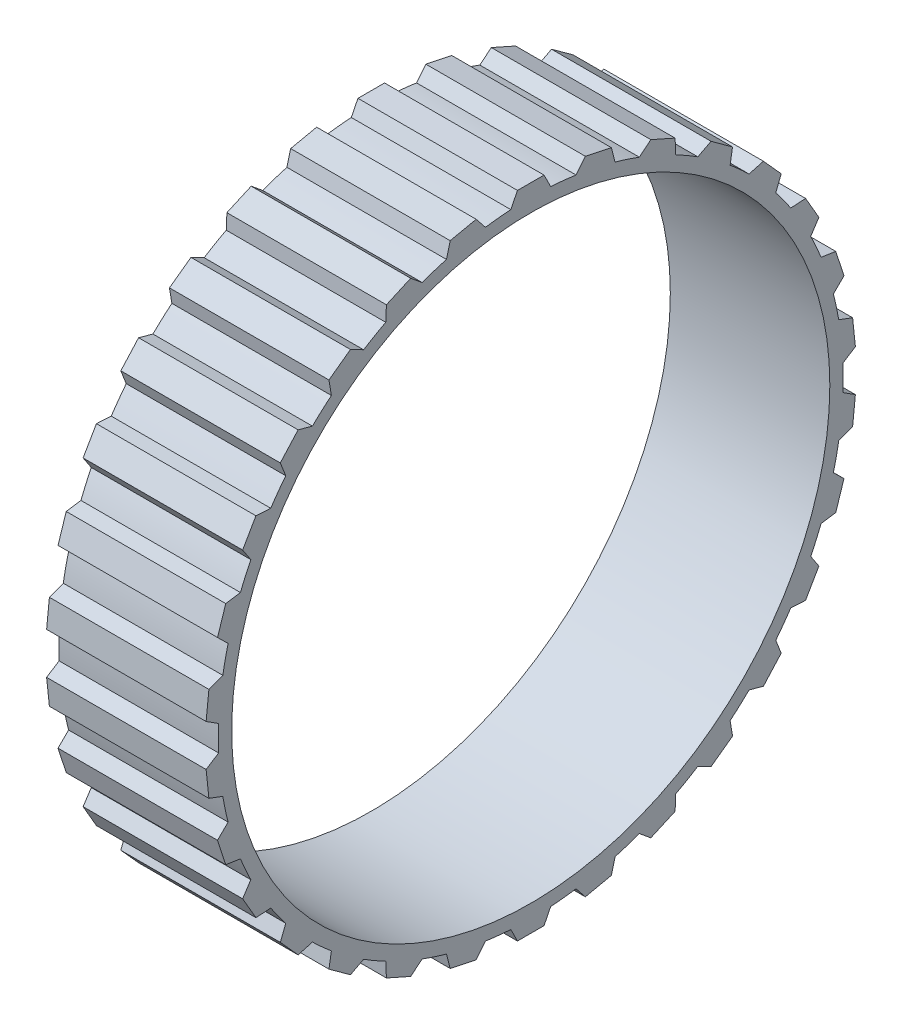
from build123d import *

# Parameters (mm, degrees)
SKETCH1_R           = 23.5
SKETCH1_R_2         = 22.5
EXTRUDE_THIN1_DEPTH = 12
BOSS_EXTRUDE2_DEPTH = 12
CIRPATTERN4_COUNT   = 30


with BuildPart() as part:
    # Sketch1 → Extrude-Thin1 (new body)
    with BuildSketch(Plane(origin=(0, 0, 0), x_dir=(0, 0, -1), z_dir=(1, 0, 0))):
        Circle(SKETCH1_R)
        Circle(SKETCH1_R_2, mode=Mode.SUBTRACT)
    extrude(amount=EXTRUDE_THIN1_DEPTH)

    # Sketch3 → Boss-Extrude2 (add)
    with BuildSketch(Plane.ZY):
        Polygon((-1, 24.452078799), (1, 24.452078799), (1.5, 23.452078799), (-1.5, 23.452078799), align=None)
    boss_extrude2 = extrude(amount=-BOSS_EXTRUDE2_DEPTH)

    # CirPattern4: Boss-Extrude2 ×30 about axis
    cirpattern4_axis = Axis((0, 0, 0), (1, 0, 0))
    for i in range(1, CIRPATTERN4_COUNT):
        add(boss_extrude2.rotate(cirpattern4_axis, i * 360 / CIRPATTERN4_COUNT))


solid = part.part
